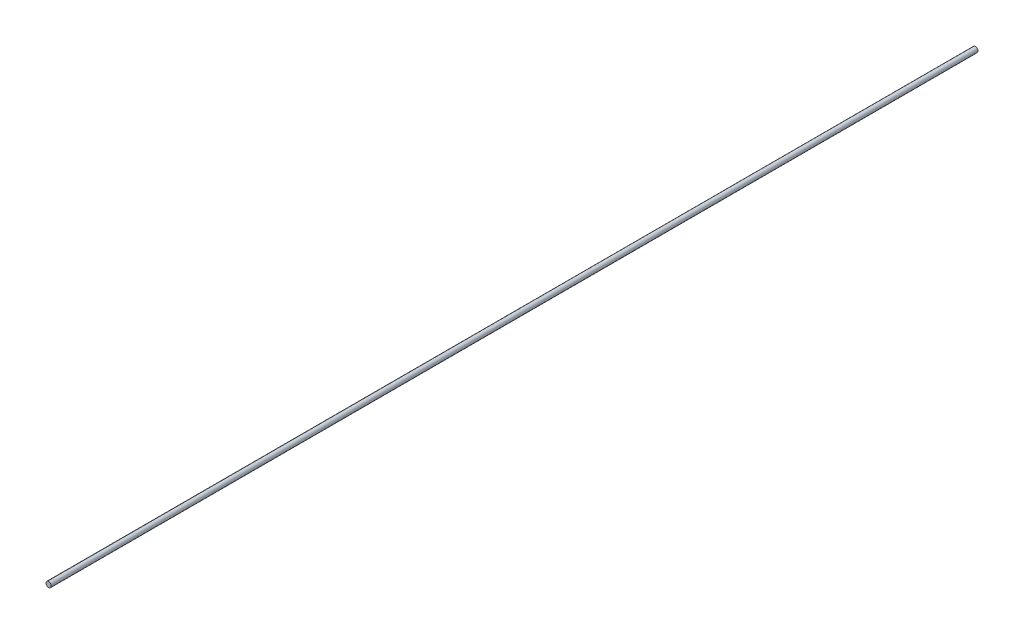
from build123d import *

# Parameters (mm, degrees)
SKETCH1_R           = 12.7
BOSS_EXTRUDE1_DEPTH = 4488.434


with BuildPart() as part:
    # Sketch1 → Boss-Extrude1 (new body)
    with BuildSketch(Plane.XY):
        Circle(SKETCH1_R)
    extrude(amount=BOSS_EXTRUDE1_DEPTH)


solid = part.part
